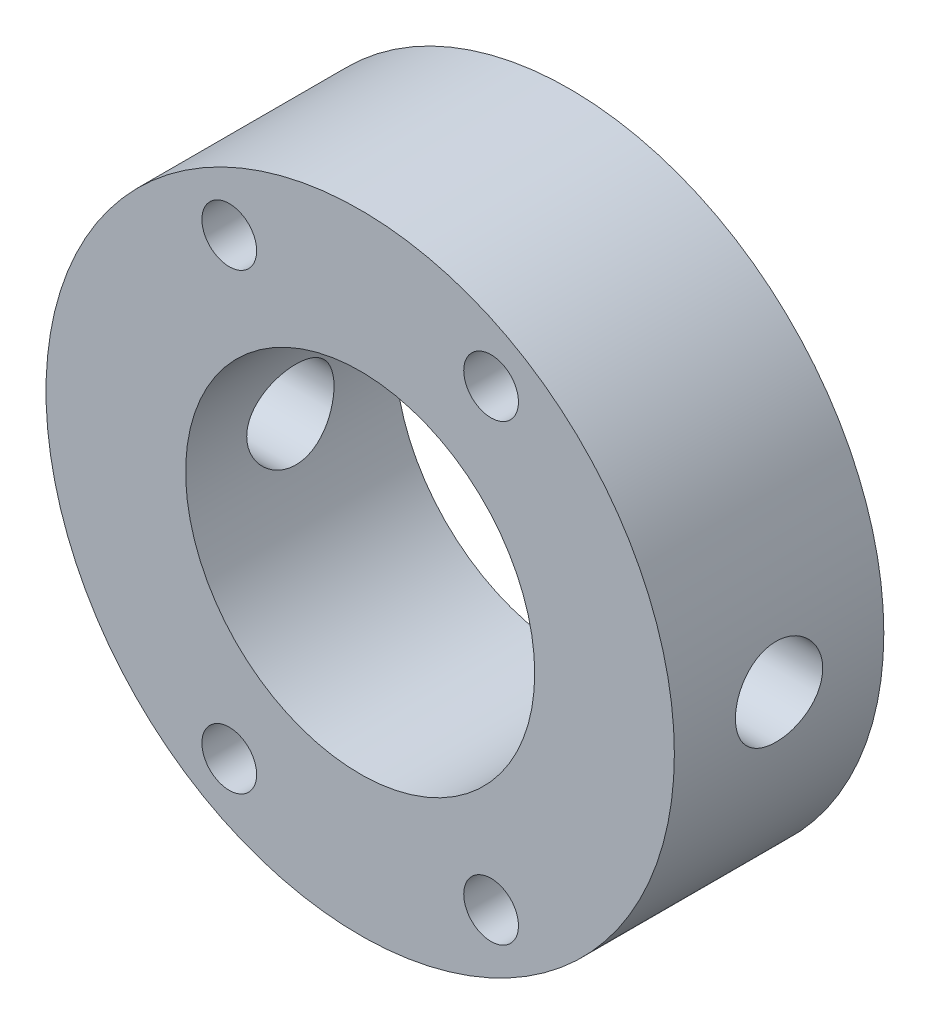
from build123d import *

# Parameters (mm, degrees)
SKETCH3_R                  = 28.575
SKETCH3_R_2                = 15.875
BOSS_EXTRUDE1_DEPTH        = 76.2
SKETCH4_R                  = 39.559010108
CUT_EXTRUDE1_DEPTH         = 133.35
F_9_0_196_DIAMETER_HOLE1_D = 4.9784
CUT_EXTRUDE2_DEPTH         = 87.252543441
CUT_EXTRUDE2_DEPTH_BACK    = 87.252543441
SKETCH7_R                  = 3.96875


with BuildPart() as part:
    # Sketch3 → Boss-Extrude1 (new, symmetric)
    with BuildSketch(Plane.XY):
        with Locations(Location((0, 0, 0), (0, 0, 180))):
            Circle(SKETCH3_R)
        with Locations(Location((0, 0, 0), (0, 0, 180))):
            Circle(SKETCH3_R_2, mode=Mode.SUBTRACT)
    extrude(amount=BOSS_EXTRUDE1_DEPTH, both=True)

    # Sketch4 → Cut-Extrude1 (cut)
    with BuildSketch(Plane(origin=(0, 0, -76.2), x_dir=(-1, 0, 0), z_dir=(0, 0, -1))):
        Circle(SKETCH4_R)
    extrude(amount=-CUT_EXTRUDE1_DEPTH, mode=Mode.SUBTRACT)

    # #9 (0.196) Diameter Hole1 (through all)
    with Locations(Plane(origin=(0, 0, 57.15), x_dir=(-1, 0, 0), z_dir=(0, 0, -1))):
        with Locations((-11.90625, -20.622229928), (-11.90625, 20.622229928), (11.90625, 20.622229928), (11.90625, -20.622229928)):
            Hole(F_9_0_196_DIAMETER_HOLE1_D / 2)

    # Sketch7 → Cut-Extrude2 (cut, two sides: drawn at the far end of the back side and taken through both)
    with BuildSketch(Plane(origin=(0, 0, 0), x_dir=(0, 0, -1), z_dir=(1, 0, 0)).offset(-CUT_EXTRUDE2_DEPTH_BACK)):
        with Locations((-66.675, 0)):
            Circle(SKETCH7_R)
    extrude(amount=CUT_EXTRUDE2_DEPTH + CUT_EXTRUDE2_DEPTH_BACK, mode=Mode.SUBTRACT)


solid = part.part
